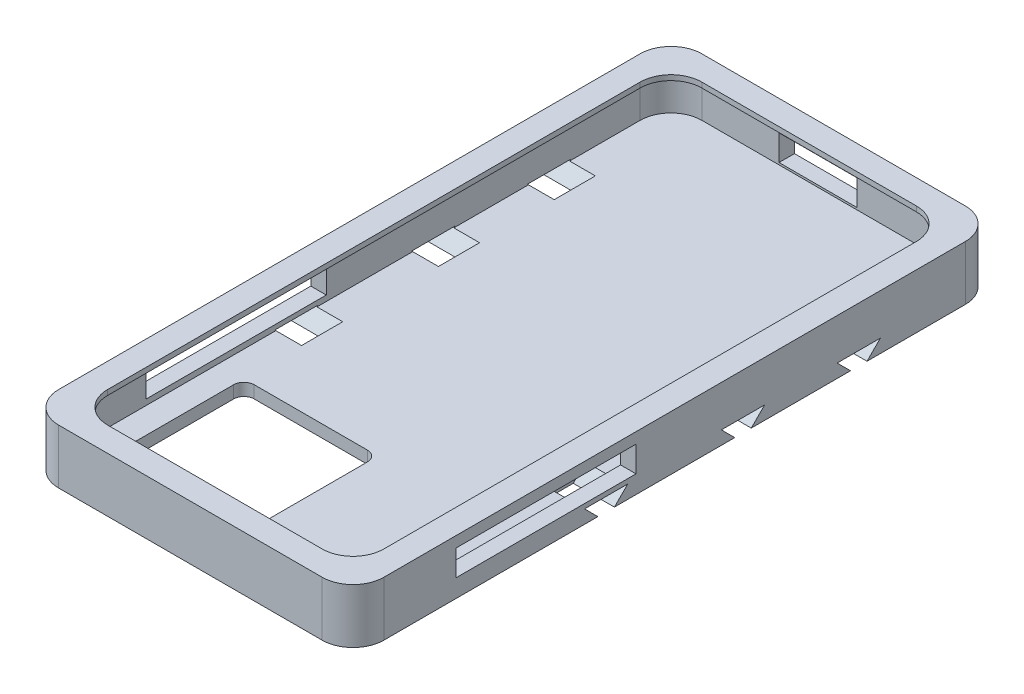
from build123d import *

# Parameters (mm, degrees)
SKETCH1_W           = 80.264
SKETCH1_H           = 158.75
BOSS_EXTRUDE1_DEPTH = 3.048
SKETCH2_W           = 80.264
SKETCH2_H           = 158.75
BOSS_EXTRUDE2_DEPTH = 10.414
FILLET2_R           = 7.62
BOSS_EXTRUDE3_START = -1.27
BOSS_EXTRUDE3_DEPTH = 1.27
CUT_EXTRUDE1_DEPTH  = 179.39590141
CUT_EXTRUDE2_DEPTH  = 10.16
SKETCH6_W           = 19.304
SKETCH6_H           = 6.35
CUT_EXTRUDE4_DEPTH  = 3.81
SKETCH7_W           = 44.45
SKETCH7_H           = 6.35
CUT_EXTRUDE5_DEPTH  = 179.39590141


with BuildPart() as part:
    # Sketch1 → Boss-Extrude1 (new body)
    with BuildSketch(Plane(origin=(0, 0, 0), x_dir=(1, 0, 0), z_dir=(0, 1, 0))):
        with Locations((40.132, -79.375)):
            Rectangle(SKETCH1_W, SKETCH1_H)
    extrude(amount=BOSS_EXTRUDE1_DEPTH)

    # Sketch2 → Boss-Extrude2 (add)
    with BuildSketch(Plane(origin=(0, 3.048, 0), x_dir=(1, 0, 0), z_dir=(0, 1, 0))):
        with Locations((40.132, -79.375)):
            Rectangle(SKETCH2_W, SKETCH2_H)
        with BuildLine():
            Line((11.43, -3.81), (68.834, -3.81))
            ThreePointArc((68.834, -3.81), (74.222153673, -6.041846327), (76.454, -11.43))
            Line((76.454, -11.43), (76.454, -147.32))
            ThreePointArc((76.454, -147.32), (74.222153673, -152.708153673), (68.834, -154.94))
            Line((68.834, -154.94), (11.43, -154.94))
            ThreePointArc((11.43, -154.94), (6.041846327, -152.708153673), (3.81, -147.32))
            Line((3.81, -147.32), (3.81, -11.43))
            ThreePointArc((3.81, -11.43), (6.041846327, -6.041846327), (11.43, -3.81))
        make_face(mode=Mode.SUBTRACT)
    extrude(amount=BOSS_EXTRUDE2_DEPTH)

    # Fillet2
    fillet2_edges = [part.edges().sort_by_distance(p)[0] for p in [
        (0, 6.731, 0),
        (80.264, 6.731, 0),
        (80.264, 6.731, 158.75),
        (0, 6.731, 158.75),
    ]]
    fillet(fillet2_edges, radius=FILLET2_R)

    # Sketch3 → Boss-Extrude3 (add)
    with BuildSketch(Plane(origin=(0, 13.462, 0), x_dir=(1, 0, 0), z_dir=(0, 1, 0)).offset(BOSS_EXTRUDE3_START)):
        with BuildLine():
            Line((11.43, -3.81), (68.834, -3.81))
            ThreePointArc((68.834, -3.81), (74.222153673, -6.041846327), (76.454, -11.43))
            Line((76.454, -11.43), (76.454, -147.32))
            ThreePointArc((76.454, -147.32), (74.222153673, -152.708153673), (68.834, -154.94))
            Line((68.834, -154.94), (11.43, -154.94))
            ThreePointArc((11.43, -154.94), (6.041846327, -152.708153673), (3.81, -147.32))
            Line((3.81, -147.32), (3.81, -11.43))
            ThreePointArc((3.81, -11.43), (6.041846327, -6.041846327), (11.43, -3.81))
        make_face()
        with BuildLine():
            Line((13.661846327, -6.041846327), (66.602153673, -6.041846327))
            ThreePointArc((66.602153673, -6.041846327), (71.990307345, -8.273692655), (74.222153673, -13.661846327))
            Line((74.222153673, -13.661846327), (74.222153673, -145.088153673))
            ThreePointArc((74.222153673, -145.088153673), (71.990307345, -150.476307345), (66.602153673, -152.708153673))
            Line((66.602153673, -152.708153673), (13.661846327, -152.708153673))
            ThreePointArc((13.661846327, -152.708153673), (8.273692655, -150.476307345), (6.041846327, -145.088153673))
            Line((6.041846327, -145.088153673), (6.041846327, -13.661846327))
            ThreePointArc((6.041846327, -13.661846327), (8.273692655, -8.273692655), (13.661846327, -6.041846327))
        make_face(mode=Mode.SUBTRACT)
    extrude(amount=BOSS_EXTRUDE3_DEPTH)

    # Sketch4 → Cut-Extrude1 (cut, through all)
    with BuildSketch(Plane.XZ):
        with BuildLine():
            Line((12.7, 148.59), (40.64, 148.59))
            ThreePointArc((40.64, 148.59), (42.436051224, 147.846051224), (43.18, 146.05))
            Line((43.18, 146.05), (43.18, 118.11))
            ThreePointArc((43.18, 118.11), (42.436051224, 116.313948776), (40.64, 115.57))
            Line((40.64, 115.57), (12.7, 115.57))
            ThreePointArc((12.7, 115.57), (10.903948776, 116.313948776), (10.16, 118.11))
            Line((10.16, 118.11), (10.16, 146.05))
            ThreePointArc((10.16, 146.05), (10.903948776, 147.846051224), (12.7, 148.59))
        make_face()
    extrude(amount=-CUT_EXTRUDE1_DEPTH, mode=Mode.SUBTRACT)

    # Sketch5 → Cut-Extrude2 (cut)
    with BuildSketch(Plane(origin=(80.264, 0, 0), x_dir=(0, 0, -1), z_dir=(1, 0, 0))):
        Polygon((-98.298, 0), (-101.6, 3.302), (-90.932, 3.302), (-94.234, 0), align=None)
        Polygon((-60.452, 0), (-57.15, 3.302), (-67.818, 3.302), (-64.516, 0), align=None)
        Polygon((-39.243, 3.302), (-35.941, 0), (-31.877, 0), (-28.575, 3.302), align=None)
    cut_extrude2 = extrude(amount=-CUT_EXTRUDE2_DEPTH, mode=Mode.SUBTRACT)

    # Mirror1: Cut-Extrude2 across plane
    add(cut_extrude2.mirror(Plane(origin=(40.132, 0, 0), x_dir=(0, 0, 1), z_dir=(1, 0, 0))), mode=Mode.SUBTRACT)

    # Sketch6 → Cut-Extrude4 (cut)
    with BuildSketch(Plane(origin=(0, 0, 0), x_dir=(-1, 0, 0), z_dir=(0, 0, -1))):
        with Locations((-40.132, 6.731)):
            Rectangle(SKETCH6_W, SKETCH6_H)
    extrude(amount=-CUT_EXTRUDE4_DEPTH, mode=Mode.SUBTRACT)

    # Sketch7 → Cut-Extrude5 (cut, through all)
    with BuildSketch(Plane.ZY):
        with Locations((111.125, 7.62)):
            Rectangle(SKETCH7_W, SKETCH7_H)
    extrude(amount=-CUT_EXTRUDE5_DEPTH, mode=Mode.SUBTRACT)


solid = part.part
